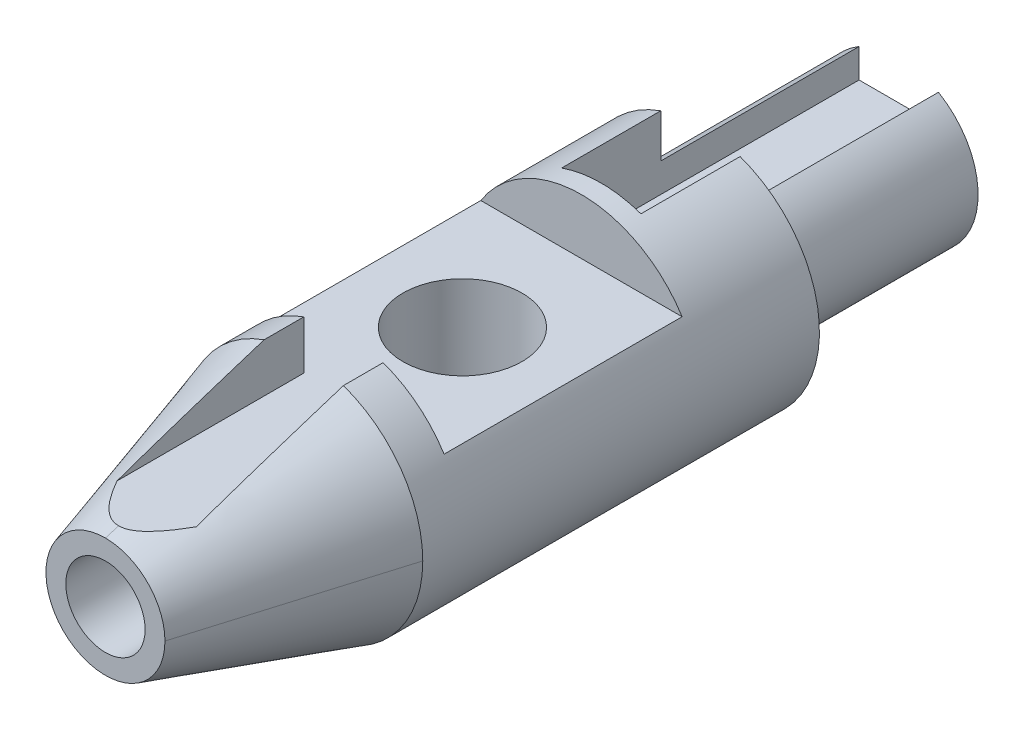
from build123d import *

# Parameters (mm, degrees)
SKETCH2_R                           = 30
BOSS_EXTRUDE1_DEPTH                 = 50
SKETCH4_R                           = 30
BOSS_EXTRUDE4_DEPTH                 = 100
CUT_EXTRUDE3_REACH                  = 157.885
CUT_EXTRUDE3_END_RADIUS             = 30
SKETCH20_W                          = 60
SKETCH20_H                          = 14
SKETCH20_W_2                        = 40
SKETCH20_H_2                        = 10
CUT_EXTRUDE3_DIRECTION_2_REACH      = 157.885
CUT_EXTRUDE3_DIRECTION_2_END_RADIUS = 30
SKETCH8_R                           = 20
BOSS_EXTRUDE6_DEPTH                 = 50
CUT_EXTRUDE14_REACH                 = 209.403
CUT_EXTRUDE14_END_RADIUS            = 30
SKETCH22_W                          = 20
SKETCH22_H                          = 60
CUT_EXTRUDE16_REACH                 = 208.155
CUT_EXTRUDE16_END_RADIUS            = 30
SKETCH23_W                          = 20
SKETCH23_H                          = 75
V_0_377_DIAMETER_HOLE2_D            = 19.999999878
V_0_377_DIAMETER_HOLE2_DEPTH        = 30
V_0_377_DIAMETER_HOLE2_TIP          = 37.320507848
CUT_EXTRUDE17_REACH                 = 209.403
SKETCH26_R                          = 15


with BuildPart() as part:
    # Sketch2 → Boss-Extrude1 (new body)
    with BuildSketch(Plane.XY):
        Circle(SKETCH2_R)
    extrude(amount=-BOSS_EXTRUDE1_DEPTH)

    # Sketch4 → Boss-Extrude4 (add)
    with BuildSketch(Plane(origin=(0, 0, -50), x_dir=(-1, 0, 0), z_dir=(0, 0, -1))):
        with Locations(Location((0, 0, 0), (0, 0, 180))):
            Circle(SKETCH4_R)
    extrude(amount=BOSS_EXTRUDE4_DEPTH)

    # Cut-Sweep1: sweep along a curve in space
    with BuildLine() as cut_sweep1_path:
        ThreePointArc((30, 0, 0), (21.213203436, 21.213203436, 0), (0, 30, 0))
        ThreePointArc((0, 30, 0), (-21.213203436, 21.213203436, 0), (-30, 0, 0))
        ThreePointArc((-30, 0, 0), (-21.213203436, -21.213203436, 0), (0, -30, 0))
        ThreePointArc((0, -30, 0), (21.213203436, -21.213203436, 0), (30, 0, 0))
    # Sketch11 → Cut-Sweep1 (sweep, cut)
    with BuildSketch(Plane(origin=(0, 0, 0), x_dir=(0, 0, -1), z_dir=(1, 0, 0))):
        Polygon((0, 15), (50, 30), (0, 30), align=None)
    sweep(path=cut_sweep1_path.line, mode=Mode.SUBTRACT)

    # Cut-Extrude3: up to this cylinder (the profile starts inside it)
    cut_extrude3_end = Plane(origin=(0, 0, -90), z_dir=(0, 0, 1)) * Cylinder(CUT_EXTRUDE3_END_RADIUS, 376.77, mode=Mode.PRIVATE)
    # Sketch20 → Cut-Extrude3 (cut, up to the surface)
    with BuildSketch(Plane(origin=(0, 0, 0), x_dir=(0, 0, -1), z_dir=(1, 0, 0)), mode=Mode.PRIVATE) as cut_extrude3_sk1:
        with Locations((90, 23)):
            Rectangle(SKETCH20_W, SKETCH20_H)
    cut_extrude3_tool1 = extrude(cut_extrude3_sk1.sketch, amount=-CUT_EXTRUDE3_REACH, mode=Mode.PRIVATE) & cut_extrude3_end
    add(cut_extrude3_tool1.solids().sort_by_distance((0, 23, -90))[0], mode=Mode.SUBTRACT)
    # Sketch20 → Cut-Extrude3 (cut, up to the surface)
    with BuildSketch(Plane(origin=(0, 0, 0), x_dir=(0, 0, -1), z_dir=(1, 0, 0)), mode=Mode.PRIVATE) as cut_extrude3_sk2:
        with Locations((90, -25)):
            Rectangle(SKETCH20_W_2, SKETCH20_H_2)
    cut_extrude3_tool2 = extrude(cut_extrude3_sk2.sketch, amount=-CUT_EXTRUDE3_REACH, mode=Mode.PRIVATE) & cut_extrude3_end
    add(cut_extrude3_tool2.solids().sort_by_distance((0, -25, -90))[0], mode=Mode.SUBTRACT)

    # Cut-Extrude3 direction 2: up to this cylinder (the profile starts inside it)
    cut_extrude3_direction_2_end = Plane(origin=(0, 0, -90), z_dir=(0, 0, 1)) * Cylinder(CUT_EXTRUDE3_DIRECTION_2_END_RADIUS, 376.77, mode=Mode.PRIVATE)
    # Sketch20 → Cut-Extrude3 direction 2 (cut, up to the surface)
    with BuildSketch(Plane(origin=(0, 0, 0), x_dir=(0, 0, -1), z_dir=(1, 0, 0)), mode=Mode.PRIVATE) as cut_extrude3_direction_2_sk1:
        with Locations((90, 23)):
            Rectangle(SKETCH20_W, SKETCH20_H)
    cut_extrude3_direction_2_tool1 = extrude(cut_extrude3_direction_2_sk1.sketch, amount=CUT_EXTRUDE3_DIRECTION_2_REACH, mode=Mode.PRIVATE) & cut_extrude3_direction_2_end
    add(cut_extrude3_direction_2_tool1.solids().sort_by_distance((0, 23, -90))[0], mode=Mode.SUBTRACT)
    # Sketch20 → Cut-Extrude3 direction 2 (cut, up to the surface)
    with BuildSketch(Plane(origin=(0, 0, 0), x_dir=(0, 0, -1), z_dir=(1, 0, 0)), mode=Mode.PRIVATE) as cut_extrude3_direction_2_sk2:
        with Locations((90, -25)):
            Rectangle(SKETCH20_W_2, SKETCH20_H_2)
    cut_extrude3_direction_2_tool2 = extrude(cut_extrude3_direction_2_sk2.sketch, amount=CUT_EXTRUDE3_DIRECTION_2_REACH, mode=Mode.PRIVATE) & cut_extrude3_direction_2_end
    add(cut_extrude3_direction_2_tool2.solids().sort_by_distance((0, -25, -90))[0], mode=Mode.SUBTRACT)

    # Sketch8 → Boss-Extrude6 (add)
    with BuildSketch(Plane(origin=(0, 0, -150), x_dir=(-1, 0, 0), z_dir=(0, 0, -1))):
        Circle(SKETCH8_R)
    extrude(amount=BOSS_EXTRUDE6_DEPTH)

    # Cut-Extrude14: up to this cylinder (the profile starts inside it)
    cut_extrude14_end = Plane(origin=(0, 0, -30), z_dir=(0, 0, 1)) * Cylinder(CUT_EXTRUDE14_END_RADIUS, 479.806, mode=Mode.PRIVATE)
    # Sketch22 → Cut-Extrude14 (cut, up to the surface)
    with BuildSketch(Plane(origin=(0, 16, 0), x_dir=(1, 0, 0), z_dir=(0, 1, 0)), mode=Mode.PRIVATE) as cut_extrude14_sk1:
        with Locations((0, 30)):
            Rectangle(SKETCH22_W, SKETCH22_H)
    cut_extrude14_tool1 = extrude(cut_extrude14_sk1.sketch, amount=CUT_EXTRUDE14_REACH, mode=Mode.PRIVATE) & cut_extrude14_end
    add(cut_extrude14_tool1.solids().sort_by_distance((0, 16, -30))[0], mode=Mode.SUBTRACT)

    # Cut-Extrude16: up to this cylinder (the profile starts inside it)
    cut_extrude16_end = Plane(origin=(0, 0, -162.5), z_dir=(0, 0, 1)) * Cylinder(CUT_EXTRUDE16_END_RADIUS, 477.31, mode=Mode.PRIVATE)
    # Sketch23 → Cut-Extrude16 (cut, up to the surface)
    with BuildSketch(Plane(origin=(0, 10, 0), x_dir=(1, 0, 0), z_dir=(0, 1, 0)), mode=Mode.PRIVATE) as cut_extrude16_sk1:
        with Locations((0, 162.5)):
            Rectangle(SKETCH23_W, SKETCH23_H)
    cut_extrude16_tool1 = extrude(cut_extrude16_sk1.sketch, amount=CUT_EXTRUDE16_REACH, mode=Mode.PRIVATE) & cut_extrude16_end
    add(cut_extrude16_tool1.solids().sort_by_distance((0, 10, -162.5))[0], mode=Mode.SUBTRACT)

    # V (0.377) Diameter Hole2
    with Locations(Plane.XY):
        with Locations((0, 0)):
            Hole(V_0_377_DIAMETER_HOLE2_D / 2, depth=V_0_377_DIAMETER_HOLE2_DEPTH)
            with Locations((0, 0, -(V_0_377_DIAMETER_HOLE2_DEPTH + V_0_377_DIAMETER_HOLE2_TIP / 2))):  # 30° drill point
                Cone(0, V_0_377_DIAMETER_HOLE2_D / 2, V_0_377_DIAMETER_HOLE2_TIP, mode=Mode.SUBTRACT)

    # Sketch26 → Cut-Extrude17 (cut, up to next)
    with BuildSketch(Plane(origin=(0, 16, 0), x_dir=(1, 0, 0), z_dir=(0, 1, 0)), mode=Mode.PRIVATE) as cut_extrude17_sk1:
        with Locations(Location((0, 90, 0), (0, 0, 270))):
            Circle(SKETCH26_R)
    cut_extrude17_tool1 = extrude(cut_extrude17_sk1.sketch, amount=-CUT_EXTRUDE17_REACH, mode=Mode.PRIVATE) & part.part
    add(cut_extrude17_tool1.solids().sort_by_distance((0, 16, -90))[0], mode=Mode.SUBTRACT)


solid = part.part
